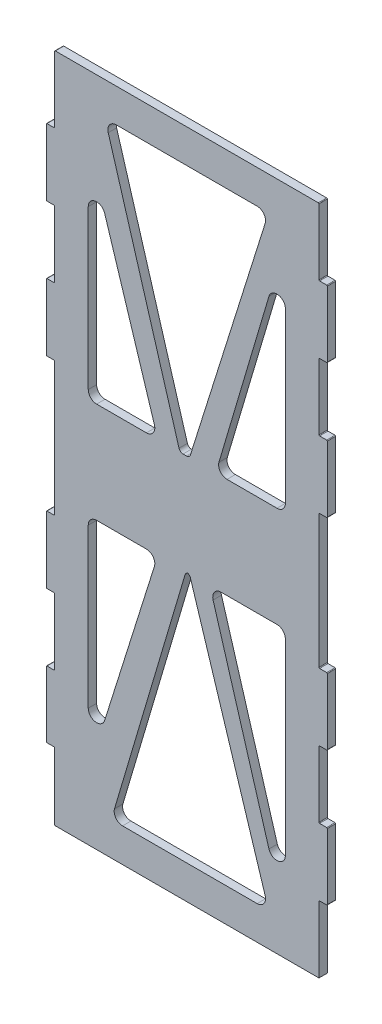
from build123d import *

# Parameters (mm, degrees)
BOSS_EXTRUDE3_DEPTH = 3.175


with BuildPart() as part:
    # Model → Boss-Extrude3 (new body)
    with BuildSketch(Plane.XY):
        with BuildLine():
            Line((431.422937797, 190.288897242), (331.664437797, 190.288897242))
            ThreePointArc((331.664437797, 190.288897242), (331.484832675, 190.36329212), (331.410437797, 190.542897242))
            Line((331.410437797, 190.542897242), (331.410437797, 215.688897242))
            ThreePointArc((331.410437797, 215.688897242), (331.33604292, 215.868502364), (331.156437797, 215.942897242))
            Line((331.156437797, 215.942897242), (328.489437797, 215.942897242))
            ThreePointArc((328.489437797, 215.942897242), (328.309832675, 216.01729212), (328.235437797, 216.196897242))
            Line((328.235437797, 216.196897242), (328.235437797, 240.834897242))
            ThreePointArc((328.235437797, 240.834897242), (328.309832675, 241.014502364), (328.489437797, 241.088897242))
            Line((328.489437797, 241.088897242), (331.156437797, 241.088897242))
            ThreePointArc((331.156437797, 241.088897242), (331.33604292, 241.16329212), (331.410437797, 241.342897242))
            Line((331.410437797, 241.342897242), (331.410437797, 266.234897242))
            ThreePointArc((331.410437797, 266.234897242), (331.33604292, 266.414502364), (331.156437797, 266.488897242))
            Line((331.156437797, 266.488897242), (328.489437797, 266.488897242))
            ThreePointArc((328.489437797, 266.488897242), (328.309832675, 266.56329212), (328.235437797, 266.742897242))
            Line((328.235437797, 266.742897242), (328.235437797, 291.634897242))
            ThreePointArc((328.235437797, 291.634897242), (328.309832675, 291.814502364), (328.489437797, 291.888897242))
            Line((328.489437797, 291.888897242), (331.156437797, 291.888897242))
            ThreePointArc((331.156437797, 291.888897242), (331.33604292, 291.96329212), (331.410437797, 292.142897242))
            Line((331.410437797, 292.142897242), (331.410437797, 342.434897242))
            ThreePointArc((331.410437797, 342.434897242), (331.33604292, 342.614502364), (331.156437797, 342.688897242))
            Line((331.156437797, 342.688897242), (328.489437797, 342.688897242))
            ThreePointArc((328.489437797, 342.688897242), (328.309832675, 342.76329212), (328.235437797, 342.942897242))
            Line((328.235437797, 342.942897242), (328.235437797, 367.834897242))
            ThreePointArc((328.235437797, 367.834897242), (328.309832675, 368.014502364), (328.489437797, 368.088897242))
            Line((328.489437797, 368.088897242), (331.156437797, 368.088897242))
            ThreePointArc((331.156437797, 368.088897242), (331.33604292, 368.16329212), (331.410437797, 368.342897242))
            Line((331.410437797, 368.342897242), (331.410437797, 393.234897242))
            ThreePointArc((331.410437797, 393.234897242), (331.33604292, 393.414502364), (331.156437797, 393.488897242))
            Line((331.156437797, 393.488897242), (328.489437797, 393.488897242))
            ThreePointArc((328.489437797, 393.488897242), (328.309832675, 393.56329212), (328.235437797, 393.742897242))
            Line((328.235437797, 393.742897242), (328.235437797, 418.634897242))
            ThreePointArc((328.235437797, 418.634897242), (328.309832675, 418.814502364), (328.489437797, 418.888897242))
            Line((328.489437797, 418.888897242), (331.156437797, 418.888897242))
            ThreePointArc((331.156437797, 418.888897242), (331.33604292, 418.96329212), (331.410437797, 419.142897242))
            Line((331.410437797, 419.142897242), (331.410437797, 444.034897242))
            ThreePointArc((331.410437797, 444.034897242), (331.484832675, 444.214502364), (331.664437797, 444.288897242))
            Line((331.664437797, 444.288897242), (431.168937797, 444.288897242))
            ThreePointArc((431.168937797, 444.288897242), (431.34854292, 444.214502364), (431.422937797, 444.034897242))
            Line((431.422937797, 444.034897242), (431.422937797, 419.142897242))
            ThreePointArc((431.422937797, 419.142897242), (431.497332675, 418.96329212), (431.676937797, 418.888897242))
            Line((431.676937797, 418.888897242), (434.343937797, 418.888897242))
            ThreePointArc((434.343937797, 418.888897242), (434.52354292, 418.814502364), (434.597937797, 418.634897242))
            Line((434.597937797, 418.634897242), (434.597937797, 393.742897242))
            ThreePointArc((434.597937797, 393.742897242), (434.52354292, 393.56329212), (434.343937797, 393.488897242))
            Line((434.343937797, 393.488897242), (431.676937797, 393.488897242))
            ThreePointArc((431.676937797, 393.488897242), (431.497332675, 393.414502364), (431.422937797, 393.234897242))
            Line((431.422937797, 393.234897242), (431.422937797, 368.342897242))
            ThreePointArc((431.422937797, 368.342897242), (431.497332675, 368.16329212), (431.676937797, 368.088897242))
            Line((431.676937797, 368.088897242), (434.343937797, 368.088897242))
            ThreePointArc((434.343937797, 368.088897242), (434.52354292, 368.014502364), (434.597937797, 367.834897242))
            Line((434.597937797, 367.834897242), (434.597937797, 342.942897242))
            ThreePointArc((434.597937797, 342.942897242), (434.52354292, 342.76329212), (434.343937797, 342.688897242))
            Line((434.343937797, 342.688897242), (431.676937797, 342.688897242))
            ThreePointArc((431.676937797, 342.688897242), (431.497332675, 342.614502364), (431.422937797, 342.434897242))
            Line((431.422937797, 342.434897242), (431.422937797, 292.142897242))
            ThreePointArc((431.422937797, 292.142897242), (431.497332675, 291.96329212), (431.676937797, 291.888897242))
            Line((431.676937797, 291.888897242), (434.343937797, 291.888897242))
            ThreePointArc((434.343937797, 291.888897242), (434.52354292, 291.814502364), (434.597937797, 291.634897242))
            Line((434.597937797, 291.634897242), (434.597937797, 266.742897242))
            ThreePointArc((434.597937797, 266.742897242), (434.52354292, 266.56329212), (434.343937797, 266.488897242))
            Line((434.343937797, 266.488897242), (431.676937797, 266.488897242))
            ThreePointArc((431.676937797, 266.488897242), (431.497332675, 266.414502364), (431.422937797, 266.234897242))
            Line((431.422937797, 266.234897242), (431.422937797, 241.342897242))
            ThreePointArc((431.422937797, 241.342897242), (431.497332675, 241.16329212), (431.676937797, 241.088897242))
            Line((431.676937797, 241.088897242), (434.343937797, 241.088897242))
            ThreePointArc((434.343937797, 241.088897242), (434.52354292, 241.014502364), (434.597937797, 240.834897242))
            Line((434.597937797, 240.834897242), (434.597937797, 215.942897242))
            ThreePointArc((434.597937797, 215.942897242), (434.52354292, 215.76329212), (434.343937797, 215.688897242))
            Line((434.343937797, 215.688897242), (431.676937797, 215.688897242))
            ThreePointArc((431.676937797, 215.688897242), (431.497332675, 215.614502364), (431.422937797, 215.434897242))
            Line((431.422937797, 215.434897242), (431.422937797, 190.288897242))
        make_face()
        with BuildLine():
            Line((382.786560027, 297.127371964), (411.075896543, 207.115846687))
            ThreePointArc((411.075896543, 207.115846687), (410.606562601, 204.285309273), (408.046966492, 202.988897242))
            Line((408.046966492, 202.988897242), (357.094405319, 202.988897242))
            ThreePointArc((357.094405319, 202.988897242), (354.550237774, 204.264466668), (354.050329968, 207.066244326))
            Line((354.050329968, 207.066244326), (380.739668991, 297.102568741))
            ThreePointArc((380.739668991, 297.102568741), (381.123130271, 297.75765158), (381.766901137, 298.15981467))
            ThreePointArc((381.766901137, 298.15981467), (382.401598049, 297.766914662), (382.786560027, 297.127371964))
        make_face(mode=Mode.SUBTRACT)
        with BuildLine():
            Line((394.40551129, 298.238897242), (415.547937797, 298.238897242))
            ThreePointArc((415.547937797, 298.238897242), (417.793001827, 297.308961272), (418.722937797, 295.063897242))
            Line((418.722937797, 295.063897242), (418.722937797, 224.025344178))
            ThreePointArc((418.722937797, 224.025344178), (416.005554119, 220.88349563), (412.504851308, 223.119667846))
            Line((412.504851308, 223.119667846), (391.362427311, 294.158212475))
            ThreePointArc((391.362427311, 294.158212475), (391.860302641, 296.961932524), (394.40551129, 298.238897242))
        make_face(mode=Mode.SUBTRACT)
        with BuildLine():
            Line((354.71801129, 431.588897242), (408.046966492, 431.588897242))
            ThreePointArc((408.046966492, 431.588897242), (410.606562601, 430.292485211), (411.075896543, 427.461947797))
            Line((411.075896543, 427.461947797), (382.786560027, 337.45042252))
            ThreePointArc((382.786560027, 337.45042252), (382.211388986, 336.646599187), (381.272095002, 336.338897242))
            Line((381.272095002, 336.338897242), (379.992498353, 336.338897242))
            ThreePointArc((379.992498353, 336.338897242), (379.043481575, 336.653792274), (378.470956978, 337.473552796))
            Line((378.470956978, 337.473552796), (351.674924794, 427.508220933))
            ThreePointArc((351.674924794, 427.508220933), (352.172805279, 430.311936061), (354.71801129, 431.588897242))
        make_face(mode=Mode.SUBTRACT)
        with BuildLine():
            Line((418.722937797, 403.356536927), (418.722937797, 339.513897242))
            ThreePointArc((418.722937797, 339.513897242), (417.793001827, 337.268833212), (415.547937797, 336.338897242))
            Line((415.547937797, 336.338897242), (396.623155319, 336.338897242))
            ThreePointArc((396.623155319, 336.338897242), (394.078987861, 337.614466553), (393.579079886, 340.416244049))
            Line((393.579079886, 340.416244049), (412.503864616, 404.25889133))
            ThreePointArc((412.503864616, 404.25889133), (416.003839459, 406.498634741), (418.722937797, 403.356536927))
        make_face(mode=Mode.SUBTRACT)
        with BuildLine():
            Line((350.314367848, 400.447983443), (369.165896543, 340.465846687))
            ThreePointArc((369.165896543, 340.465846687), (368.696562601, 337.635309273), (366.136966492, 336.338897242))
            Line((366.136966492, 336.338897242), (347.285437797, 336.338897242))
            ThreePointArc((347.285437797, 336.338897242), (345.040373767, 337.268833212), (344.110437797, 339.513897242))
            Line((344.110437797, 339.513897242), (344.110437797, 399.496038941))
            ThreePointArc((344.110437797, 399.496038941), (346.803894766, 402.634304431), (350.314367848, 400.447983443))
        make_face(mode=Mode.SUBTRACT)
        with BuildLine():
            Line((369.165896543, 294.111947797), (350.314367848, 234.129811041))
            ThreePointArc((350.314367848, 234.129811041), (346.803894766, 231.943490053), (344.110437797, 235.081755542))
            Line((344.110437797, 235.081755542), (344.110437797, 295.063897242))
            ThreePointArc((344.110437797, 295.063897242), (345.040373767, 297.308961272), (347.285437797, 298.238897242))
            Line((347.285437797, 298.238897242), (366.136966492, 298.238897242))
            ThreePointArc((366.136966492, 298.238897242), (368.696562601, 296.942485211), (369.165896543, 294.111947797))
        make_face(mode=Mode.SUBTRACT)
    extrude(amount=BOSS_EXTRUDE3_DEPTH)


solid = part.part
